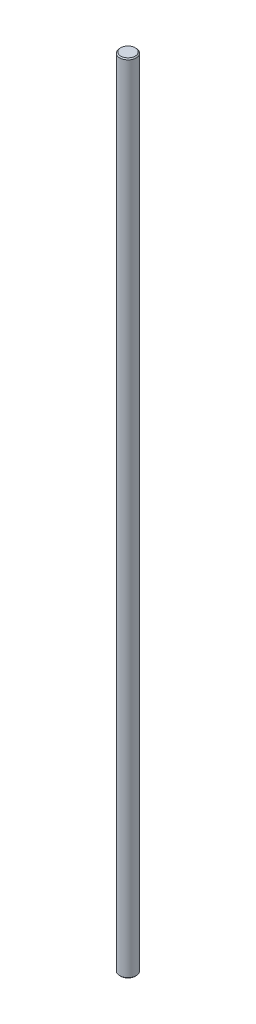
from build123d import *

# Parameters (mm, degrees)
SKETCH1_R           = 3.95
BOSS_EXTRUDE1_DEPTH = 380
CHAMFER1_SIZE       = 0.5
CHAMFER2_SIZE       = 0.5


with BuildPart() as part:
    # Sketch1 → Boss-Extrude1 (new body)
    with BuildSketch(Plane(origin=(0, 0, 0), x_dir=(1, 0, 0), z_dir=(0, 1, 0))):
        with Locations(Location((0, 0, 0), (0, 0, 270))):
            Circle(SKETCH1_R)
    extrude(amount=BOSS_EXTRUDE1_DEPTH)

    # Chamfer1
    chamfer1_edges = [part.edges().sort_by_distance(p)[0] for p in [
        (0, 380, -3.95),
    ]]
    chamfer(chamfer1_edges, length=CHAMFER1_SIZE)

    # Chamfer2
    chamfer2_edges = [part.edges().sort_by_distance(p)[0] for p in [
        (0, 0, -3.95),
    ]]
    chamfer(chamfer2_edges, length=CHAMFER2_SIZE)


solid = part.part
